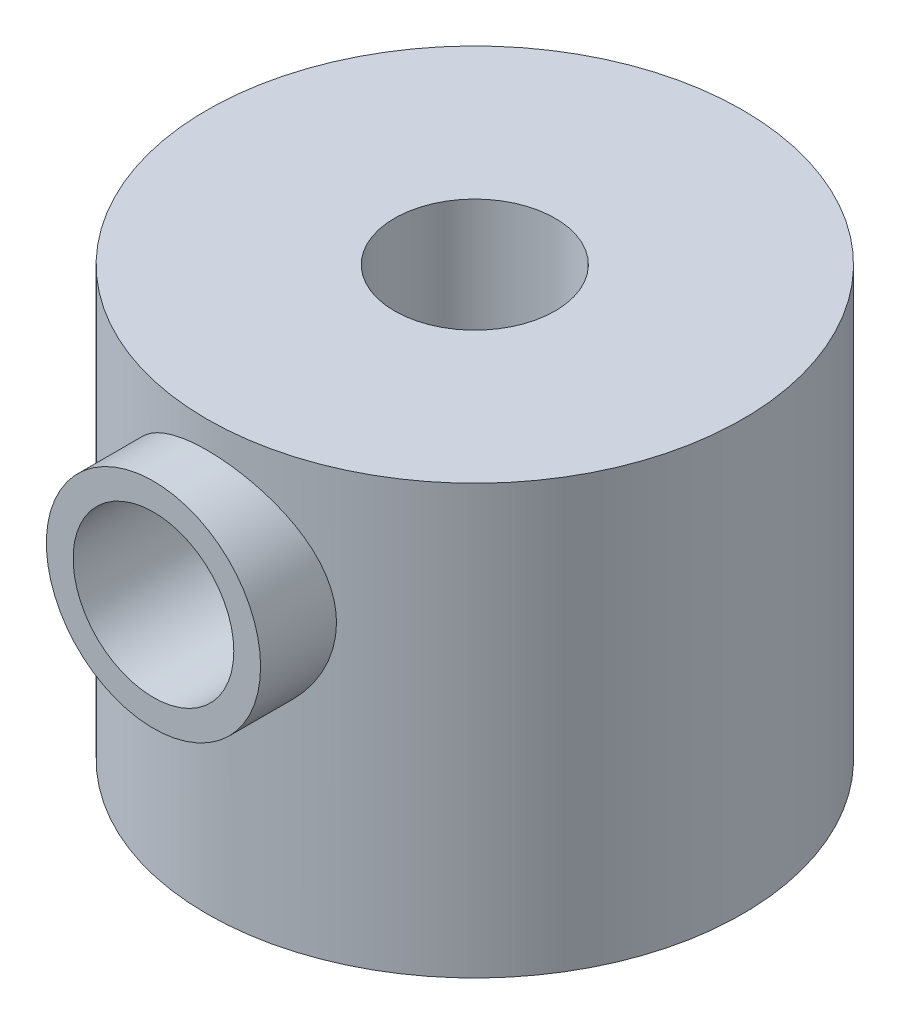
from build123d import *

# Parameters (mm, degrees)
SKETCH1_R               = 5
SKETCH1_R_2             = 1.5
BOSS_EXTRUDE1_DEPTH     = 8
SKETCH6_R               = 2
BOSS_EXTRUDE4_DEPTH     = 3.5
CUT_EXTRUDE3_REACH      = 16.491
CUT_EXTRUDE3_END_RADIUS = 1.5
SKETCH7_R               = 1.5


with BuildPart() as part:
    # Sketch1 → Boss-Extrude1 (new body)
    with BuildSketch(Plane(origin=(0, 0, 0), x_dir=(1, 0, 0), z_dir=(0, 1, 0))):
        with Locations(Location((0, 0, 0), (0, 0, 270))):
            Circle(SKETCH1_R)
        with Locations(Location((0, 0, 0), (0, 0, 270))):
            Circle(SKETCH1_R_2, mode=Mode.SUBTRACT)
    extrude(amount=BOSS_EXTRUDE1_DEPTH)

    # Sketch6 → Boss-Extrude4 (add)
    with BuildSketch(Plane.XY.offset(6)):
        with Locations((0, 5.5)):
            Circle(SKETCH6_R)
    extrude(amount=-BOSS_EXTRUDE4_DEPTH)

    # Cut-Extrude3: up to this cylinder (the profile starts outside it)
    cut_extrude3_end = Plane(origin=(0, 5.5, 0), z_dir=(0, -1, 0)) * Cylinder(CUT_EXTRUDE3_END_RADIUS, 36.982, mode=Mode.PRIVATE)
    # Sketch7 → Cut-Extrude3 (cut, up to the surface)
    with BuildSketch(Plane.XY.offset(6), mode=Mode.PRIVATE) as cut_extrude3_sk1:
        with Locations((0, 5.5)):
            Circle(SKETCH7_R)
    cut_extrude3_tool1 = extrude(cut_extrude3_sk1.sketch, amount=-CUT_EXTRUDE3_REACH, mode=Mode.PRIVATE) - cut_extrude3_end
    add(cut_extrude3_tool1.solids().sort_by_distance((0, 5.5, 6))[0], mode=Mode.SUBTRACT)


solid = part.part
